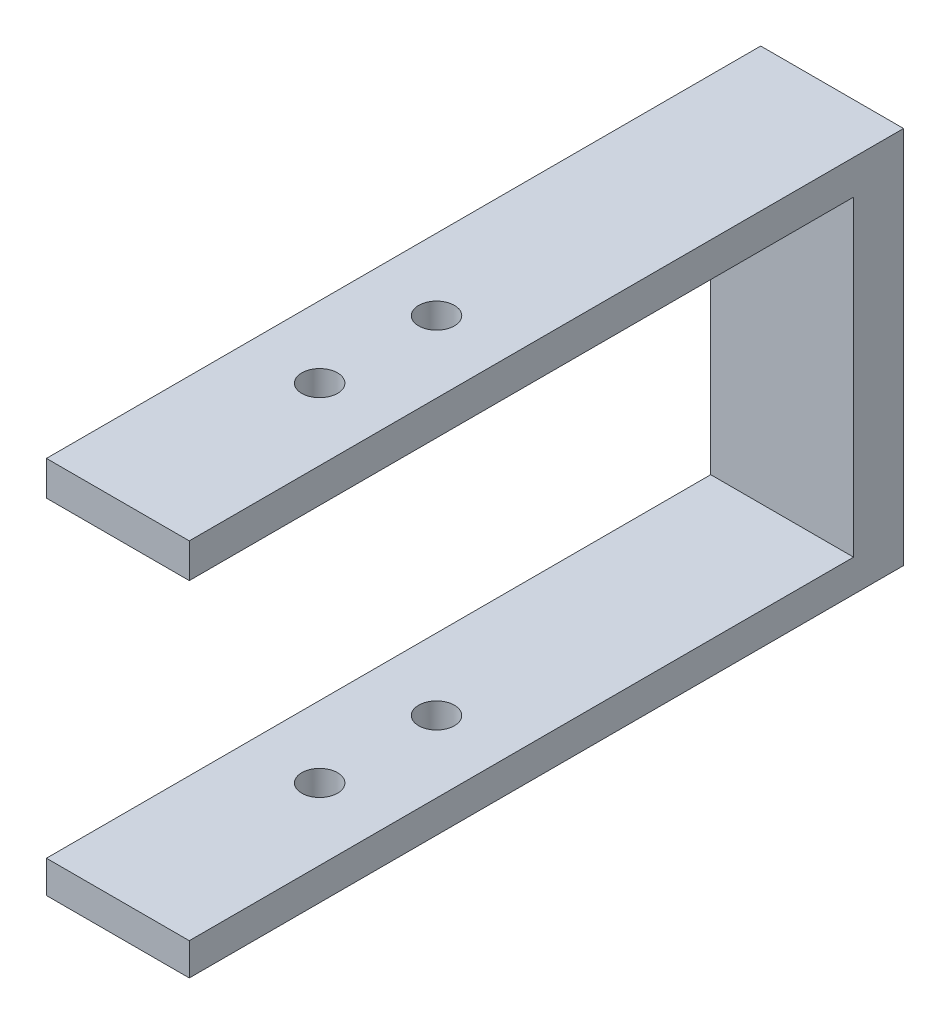
from build123d import *

# Parameters (mm, degrees)
SKETCH1_W           = 20
SKETCH1_H           = 100
BOSS_EXTRUDE1_DEPTH = 53
SKETCH2_W           = 20
SKETCH2_H           = 22.115254232
CUT_EXTRUDE1_DEPTH  = 93
SKETCH4_W           = 20
SKETCH4_H           = 7.428579278
CUT_EXTRUDE3_DEPTH  = 93
SKETCH5_W           = 20
SKETCH5_H           = 14.111734172
CUT_EXTRUDE4_DEPTH  = 93
SKETCH6_R           = 2.5
CUT_EXTRUDE5_DEPTH  = 70
SKETCH8_R           = 2.5
CUT_EXTRUDE7_DEPTH  = 67


with BuildPart() as part:
    # Sketch1 → Boss-Extrude1 (new body)
    with BuildSketch(Plane(origin=(0, 0, 0), x_dir=(1, 0, 0), z_dir=(0, 1, 0))):
        Rectangle(SKETCH1_W, SKETCH1_H)
    extrude(amount=BOSS_EXTRUDE1_DEPTH)

    # Sketch2 → Cut-Extrude1 (cut)
    with BuildSketch(Plane.XY.offset(50)):
        with Locations((0, 15.581680587)):
            Rectangle(SKETCH2_W, SKETCH2_H)
    extrude(amount=-CUT_EXTRUDE1_DEPTH, mode=Mode.SUBTRACT)

    # Sketch4 → Cut-Extrude3 (cut)
    with BuildSketch(Plane.XY.offset(50)):
        with Locations((0, 30.353597342)):
            Rectangle(SKETCH4_W, SKETCH4_H)
    extrude(amount=-CUT_EXTRUDE3_DEPTH, mode=Mode.SUBTRACT)

    # Sketch5 → Cut-Extrude4 (cut)
    with BuildSketch(Plane.XY.offset(50)):
        with Locations((0, 41.123754067)):
            Rectangle(SKETCH5_W, SKETCH5_H)
    extrude(amount=-CUT_EXTRUDE4_DEPTH, mode=Mode.SUBTRACT)

    # Sketch6 → Cut-Extrude5 (cut)
    with BuildSketch(Plane(origin=(0, 53, 0), x_dir=(1, 0, 0), z_dir=(0, 1, 0))):
        with Locations(Location((0, -5.385612406, 0), (0, 0, 270))):
            Circle(SKETCH6_R)
    extrude(amount=-CUT_EXTRUDE5_DEPTH, mode=Mode.SUBTRACT)

    # Sketch8 → Cut-Extrude7 (cut)
    with BuildSketch(Plane(origin=(0, 53, 0), x_dir=(1, 0, 0), z_dir=(0, 1, 0))):
        with Locations(Location((0, -21.748837603, 0), (0, 0, 270))):
            Circle(SKETCH8_R)
    extrude(amount=-CUT_EXTRUDE7_DEPTH, mode=Mode.SUBTRACT)


solid = part.part
